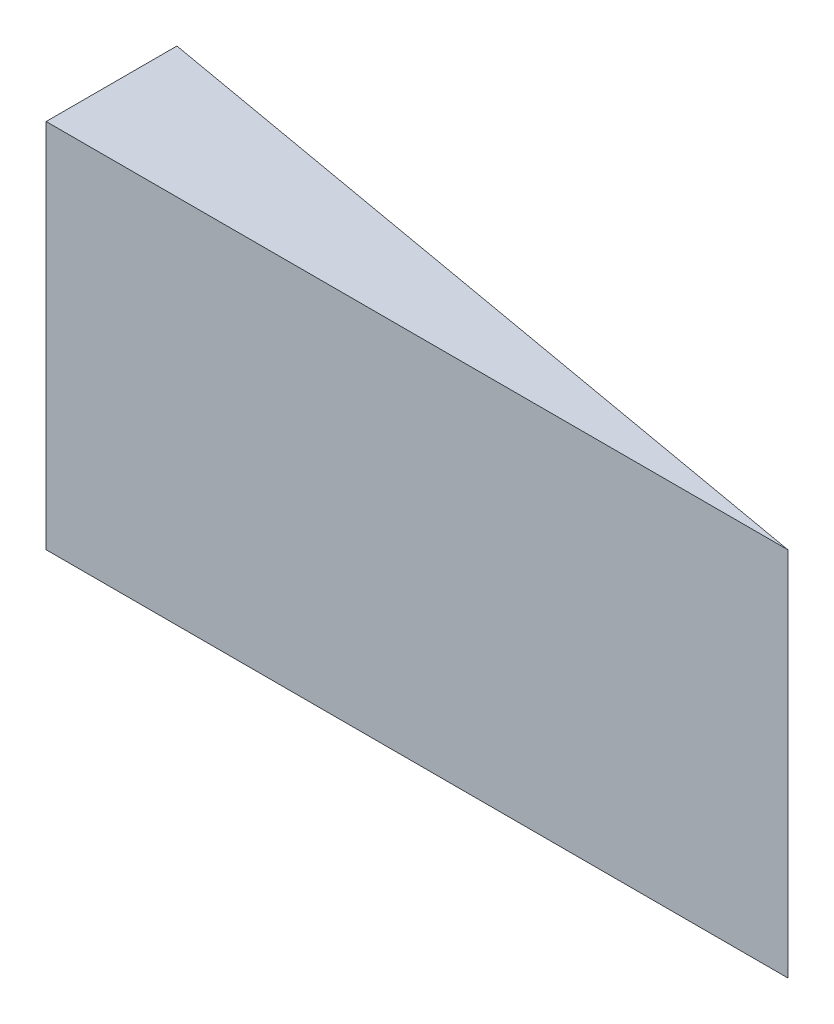
from build123d import *

# Parameters (mm, degrees)
BOSS_EXTRUDE1_DEPTH = 20


with BuildPart() as part:
    # Sketch1 → Boss-Extrude1 (new body)
    with BuildSketch(Plane(origin=(0, 0, 0), x_dir=(1, 0, 0), z_dir=(0, 1, 0))):
        Polygon((0, 0), (40, 0), (0, 7.053079228), align=None)
    extrude(amount=BOSS_EXTRUDE1_DEPTH)


solid = part.part
